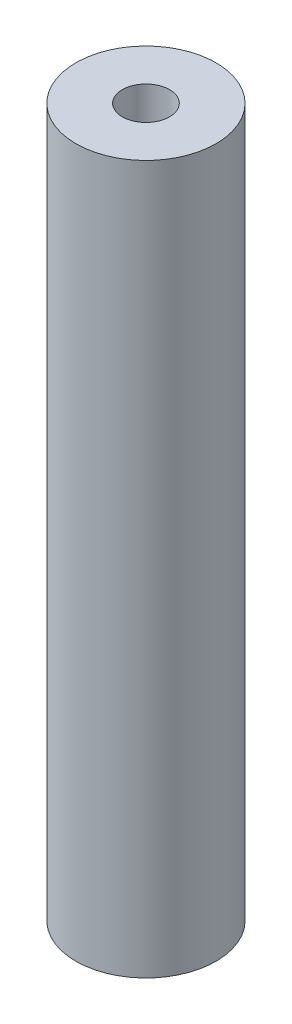
from build123d import *

# Parameters (mm, degrees)
SKETCH1_R           = 2.97
SKETCH1_R_2         = 1
BOSS_EXTRUDE1_DEPTH = 30


with BuildPart() as part:
    # Sketch1 → Boss-Extrude1 (new body)
    with BuildSketch(Plane(origin=(0, 0, 0), x_dir=(1, 0, 0), z_dir=(0, 1, 0))):
        with Locations(Location((0, 0, 0), (0, 0, 270))):
            Circle(SKETCH1_R)
        with Locations(Location((0, 0, 0), (0, 0, 270))):
            Circle(SKETCH1_R_2, mode=Mode.SUBTRACT)
    extrude(amount=BOSS_EXTRUDE1_DEPTH)


solid = part.part
